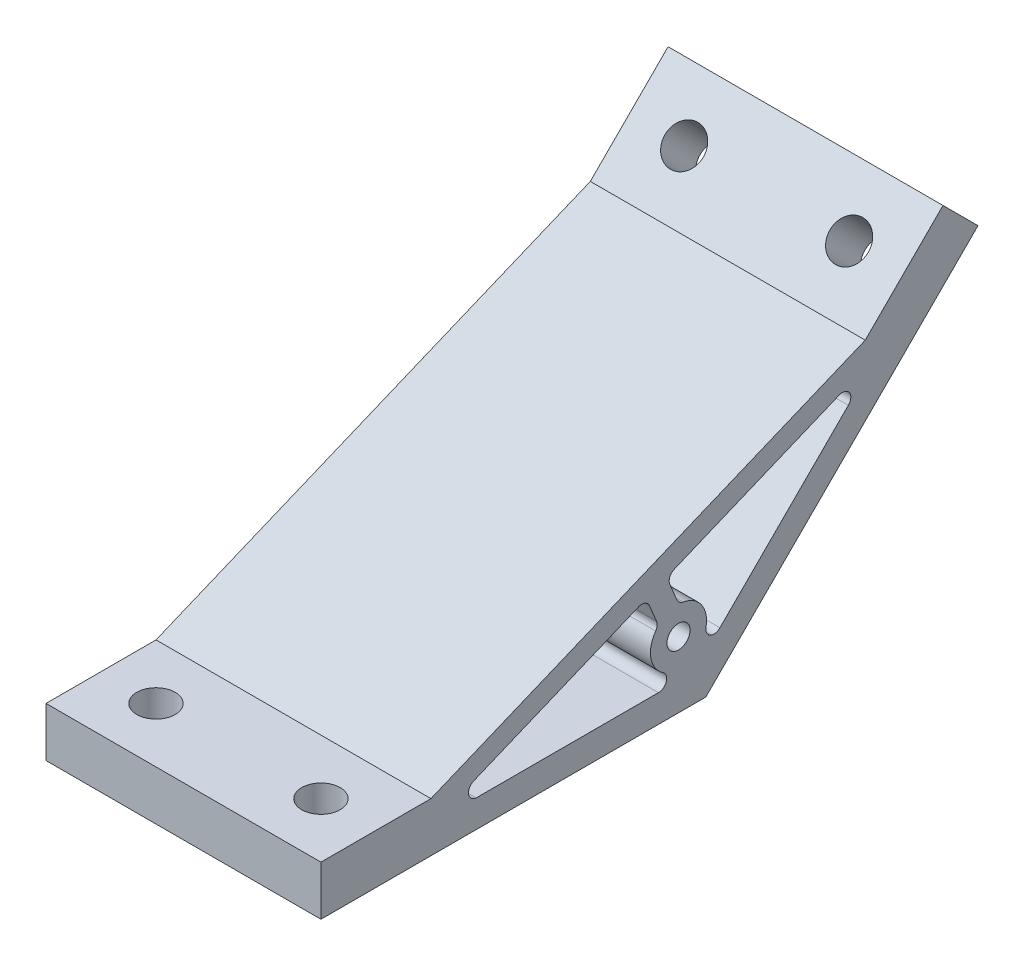
from build123d import *

# Parameters (mm, degrees)
BOSS_EXTRUDE1_DEPTH      = 25
BOSS_EXTRUDE1_DEPTH_BACK = 25
SKETCH1_R                = 2.1
SKETCH2_R                = 3.5
CUT_EXTRUDE1_DEPTH       = 9
SKETCH3_R                = 3.5
CUT_EXTRUDE2_DEPTH       = 9


with BuildPart() as part:
    # Sketch1 → Boss-Extrude1 (new, two sides: drawn at the far end of the back side and taken through both)
    with BuildSketch(Plane(origin=(0, 0, 0), x_dir=(0, 0, -1), z_dir=(1, 0, 0)).offset(-BOSS_EXTRUDE1_DEPTH_BACK)):
        Polygon((-70, 0), (0, 0), (49.497474683, 49.497474683), (43.133513652, 55.861435714), (28.991378029, 41.71930009), (-49.991379635, 9), (-70, 9), align=None)
        with Locations((-4.970562748, 12)):
            Circle(SKETCH1_R, mode=Mode.SUBTRACT)
        with BuildLine():
            Line((-6.551793043, 21.043679481), (-5.264121815, 17.934966139))
            ThreePointArc((-5.264121815, 17.934966139), (-4.812340099, 17.335290392), (-4.126543478, 17.029675086))
            ThreePointArc((-4.126543478, 17.029675086), (-0.768310337, 14.889822601), (0.028067769, 10.988222878))
            ThreePointArc((0.028067769, 10.988222878), (0.788934633, 9.368950353), (2.558913388, 9.6299812))
            Line((2.558913388, 9.6299812), (25.924897249, 32.995965061))
            ThreePointArc((25.924897249, 32.995965061), (26.111441495, 34.889980582), (24.290211928, 35.442444531))
            Line((24.290211928, 35.442444531), (-5.739998892, 23.003523928))
            ThreePointArc((-5.739998892, 23.003523928), (-6.551793043, 22.191729778), (-6.551793043, 21.043679481))
        make_face(mode=Mode.SUBTRACT)
        with BuildLine():
            Line((-41.755939666, 5.002860881), (-8.61897952, 5.000000011))
            ThreePointArc((-8.61897952, 5.000000011), (-7.181021866, 6.072446959), (-7.79931621, 7.756364052))
            ThreePointArc((-7.79931621, 7.756364052), (-9.986482643, 11.077634818), (-9.123891859, 14.959705611))
            ThreePointArc((-9.123891859, 14.959705611), (-8.855063072, 15.660739707), (-8.959639945, 16.40423241))
            Line((-8.959639945, 16.40423241), (-10.247311173, 19.512945751))
            ThreePointArc((-10.247311173, 19.512945751), (-11.013696575, 20.305047115), (-12.114513279, 20.35957911))
            Line((-12.114513279, 20.35957911), (-42.237227636, 7.885876778))
            ThreePointArc((-42.237227636, 7.885876778), (-43.142866755, 6.253009403), (-41.755939666, 5.002860881))
        make_face(mode=Mode.SUBTRACT)
    extrude(amount=BOSS_EXTRUDE1_DEPTH + BOSS_EXTRUDE1_DEPTH_BACK)

    # Sketch2 → Cut-Extrude1 (cut)
    with BuildSketch(Plane(origin=(0, 0, 0), x_dir=(1, 0, 0), z_dir=(0, 1, 0))):
        with Locations((-15, -60)):
            Circle(SKETCH2_R)
    extrude(amount=CUT_EXTRUDE1_DEPTH, mode=Mode.SUBTRACT)

    # Sketch3 → Cut-Extrude2 (cut)
    with BuildSketch(Plane(origin=(0, 0, 0), x_dir=(1, 0, 0), z_dir=(0, 1, 0))):
        with Locations((15, -60)):
            Circle(SKETCH3_R)
    extrude(amount=CUT_EXTRUDE2_DEPTH, mode=Mode.SUBTRACT)

    # Sketch4 → Cut-Revolve1 (revolve, cut)
    with BuildSketch(Plane(origin=(15, 0, 0), x_dir=(0, 0, -1), z_dir=(1, 0, 0))):
        Polygon((36.062445841, 48.790367902), (38.537319575, 51.265241636), (44.901280605, 44.901280605), (42.426406871, 42.426406871), align=None)
    revolve(axis=Axis((15, 42.426406871, -42.426406871), (0, 0.7071067811865476, 0.7071067811865476)), mode=Mode.SUBTRACT)

    # Sketch5 → Cut-Revolve2 (revolve, cut)
    with BuildSketch(Plane(origin=(-15, 0, 0), x_dir=(0, 0, -1), z_dir=(1, 0, 0))):
        Polygon((36.062445841, 48.790367902), (38.537319575, 51.265241636), (44.901280605, 44.901280605), (42.426406871, 42.426406871), align=None)
    revolve(axis=Axis((-15, 42.426406871, -42.426406871), (0, 0.7071067811865476, 0.7071067811865476)), mode=Mode.SUBTRACT)


solid = part.part
